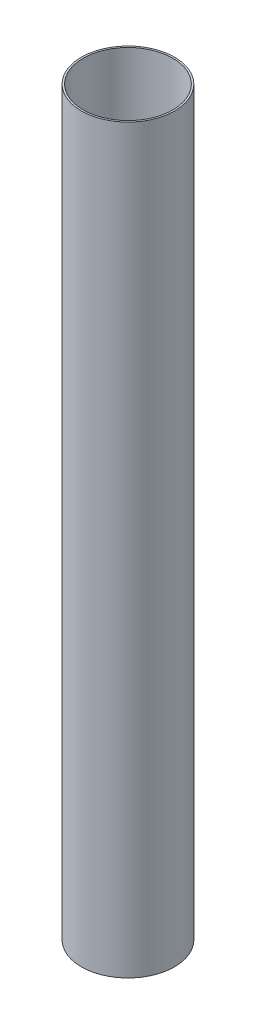
from build123d import *

# Parameters (mm, degrees)
BOSS_EXTRUDE1_DEPTH      = 315
BOSS_EXTRUDE1_DEPTH_BACK = 315
SKETCH1_R                = 39.6
SKETCH1_R_2              = 38.1


with BuildPart() as part:
    # Sketch1 → Boss-Extrude1 (new, two sides: drawn at the far end of the back side and taken through both)
    with BuildSketch(Plane(origin=(0, 0, 0), x_dir=(1, 0, 0), z_dir=(0, 1, 0)).offset(-BOSS_EXTRUDE1_DEPTH_BACK)):
        Circle(SKETCH1_R)
        Circle(SKETCH1_R_2, mode=Mode.SUBTRACT)
    extrude(amount=BOSS_EXTRUDE1_DEPTH + BOSS_EXTRUDE1_DEPTH_BACK)


solid = part.part
